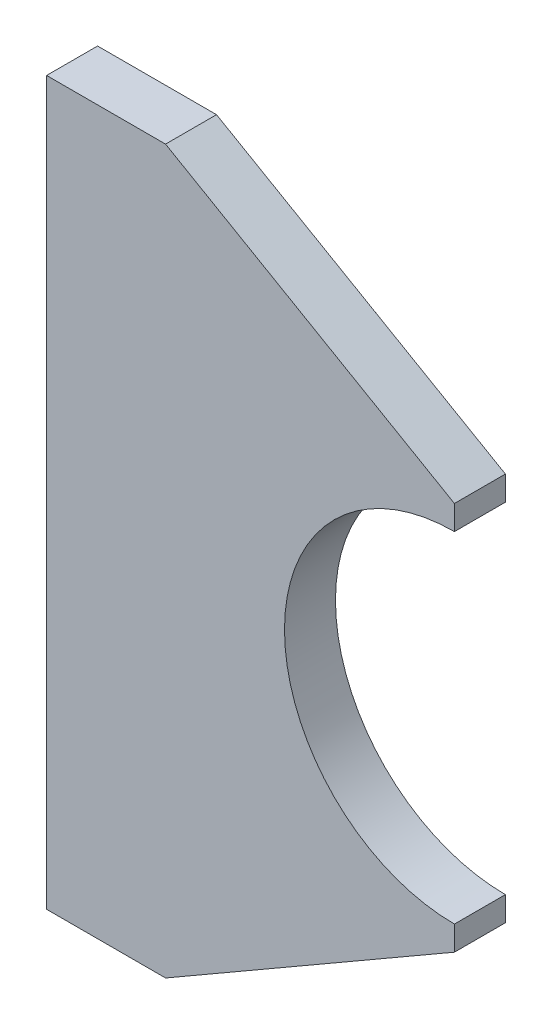
from build123d import *

# Parameters (mm, degrees)
BOSS_EXTRUDE1_DEPTH = 3


with BuildPart() as part:
    # Sketch1 → Boss-Extrude1 (new, symmetric)
    with BuildSketch(Plane.XY):
        with BuildLine():
            Line((-48, -42.5), (-48, 42.5))
            Line((-48, 42.5), (-34, 42.5))
            Line((-34, 42.5), (0, 22.870090848))
            Line((0, 22.870090848), (0, 20))
            ThreePointArc((0, 20), (-20, 0), (0, -20))
            Line((0, -20), (0, -22.870090848))
            Line((0, -22.870090848), (-34, -42.5))
            Line((-34, -42.5), (-48, -42.5))
        make_face()
    extrude(amount=BOSS_EXTRUDE1_DEPTH, both=True)


solid = part.part
